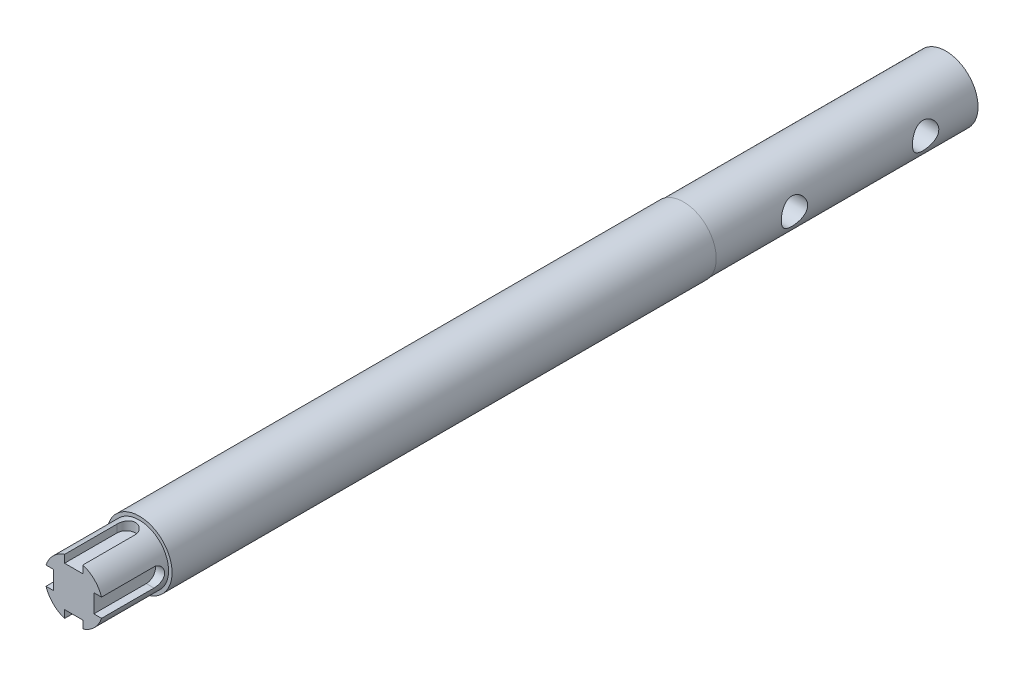
from build123d import *

# Parameters (mm, degrees)
SKETCH1_R               = 24.95
BOSS_EXTRUDE1_DEPTH     = 332.5
CUT_EXTRUDE1_DEPTH      = 335.366946632
CUT_EXTRUDE1_DEPTH_BACK = 335.366946632
SKETCH2_R               = 10.05
CUT_EXTRUDE2_DEPTH      = 337.253855116
SKETCH5_OUTSIDE_W       = 185.646
SKETCH5_OUTSIDE_H       = 185.646
SKETCH5_OUTSIDE_R       = 24.61
CUT_EXTRUDE4_DEPTH      = 200
SKETCH7_OUTSIDE_W       = 185.646
SKETCH7_OUTSIDE_H       = 185.646
SKETCH7_OUTSIDE_R       = 22.3
CUT_EXTRUDE6_DEPTH      = 50
CUT_EXTRUDE8_START      = -3.2
CUT_EXTRUDE8_DEPTH      = 13.2
CIRPATTERN1_COUNT       = 4


with BuildPart() as part:
    # Sketch1 → Boss-Extrude1 (new, symmetric)
    with BuildSketch(Plane.XY):
        Circle(SKETCH1_R)
    extrude(amount=BOSS_EXTRUDE1_DEPTH, both=True)

    # Sketch2 → Cut-Extrude1 (cut, two sides: drawn at the far end of the back side and taken through both)
    with BuildSketch(Plane(origin=(0, 0, 0), x_dir=(0, 0, -1), z_dir=(1, 0, 0)).offset(-CUT_EXTRUDE1_DEPTH_BACK)):
        with Locations(Location((192.5, 0, 0), (0, 0, 180))):
            Circle(SKETCH2_R)
        with Locations(Location((292.5, 0, 0), (0, 0, 180))):
            Circle(SKETCH2_R)
    extrude(amount=CUT_EXTRUDE1_DEPTH + CUT_EXTRUDE1_DEPTH_BACK, mode=Mode.SUBTRACT)

    # Sketch3 → Cut-Extrude2 (cut, through all)
    with BuildSketch(Plane(origin=(-18.5, 0, 0), x_dir=(0, 0, -1), z_dir=(1, 0, 0))):
        with BuildLine():
            Line((-212.5, -7), (-170.5, -7))
            ThreePointArc((-170.5, -7), (-163.5, 0), (-170.5, 7))
            Line((-170.5, 7), (-212.5, 7))
            ThreePointArc((-212.5, 7), (-219.5, 0), (-212.5, -7))
        make_face()
    extrude(amount=-CUT_EXTRUDE2_DEPTH, mode=Mode.SUBTRACT)

    # Sketch5 outside → Cut-Extrude4 (cut)
    with BuildSketch(Plane(origin=(0, 0, -332.5), x_dir=(-1, 0, 0), z_dir=(0, 0, -1))):
        Rectangle(SKETCH5_OUTSIDE_W, SKETCH5_OUTSIDE_H)
        Circle(SKETCH5_OUTSIDE_R, mode=Mode.SUBTRACT)
    extrude(amount=-CUT_EXTRUDE4_DEPTH, mode=Mode.SUBTRACT)

    # Sketch7 outside → Cut-Extrude6 (cut)
    with BuildSketch(Plane.XY.offset(332.5)):
        Rectangle(SKETCH7_OUTSIDE_W, SKETCH7_OUTSIDE_H)
        Circle(SKETCH7_OUTSIDE_R, mode=Mode.SUBTRACT)
    extrude(amount=-CUT_EXTRUDE6_DEPTH, mode=Mode.SUBTRACT)

    # Sketch9 → Cut-Extrude8 (cut)
    with BuildSketch(Plane.ZY.offset(18.5).offset(CUT_EXTRUDE8_START)):
        with BuildLine():
            Line((292.5, 7), (332.5, 7))
            ThreePointArc((332.5, 7), (339.5, 0), (332.5, -7))
            Line((332.5, -7), (292.5, -7))
            ThreePointArc((292.5, -7), (285.5, 0), (292.5, 7))
        make_face()
    cut_extrude8 = extrude(amount=CUT_EXTRUDE8_DEPTH, mode=Mode.SUBTRACT)

    # CirPattern1: Cut-Extrude8 ×4 about axis
    cirpattern1_axis = Axis((0, 0, 0), (0, 0, 1))
    for i in range(1, CIRPATTERN1_COUNT):
        add(cut_extrude8.rotate(cirpattern1_axis, i * 360 / CIRPATTERN1_COUNT), mode=Mode.SUBTRACT)


solid = part.part
